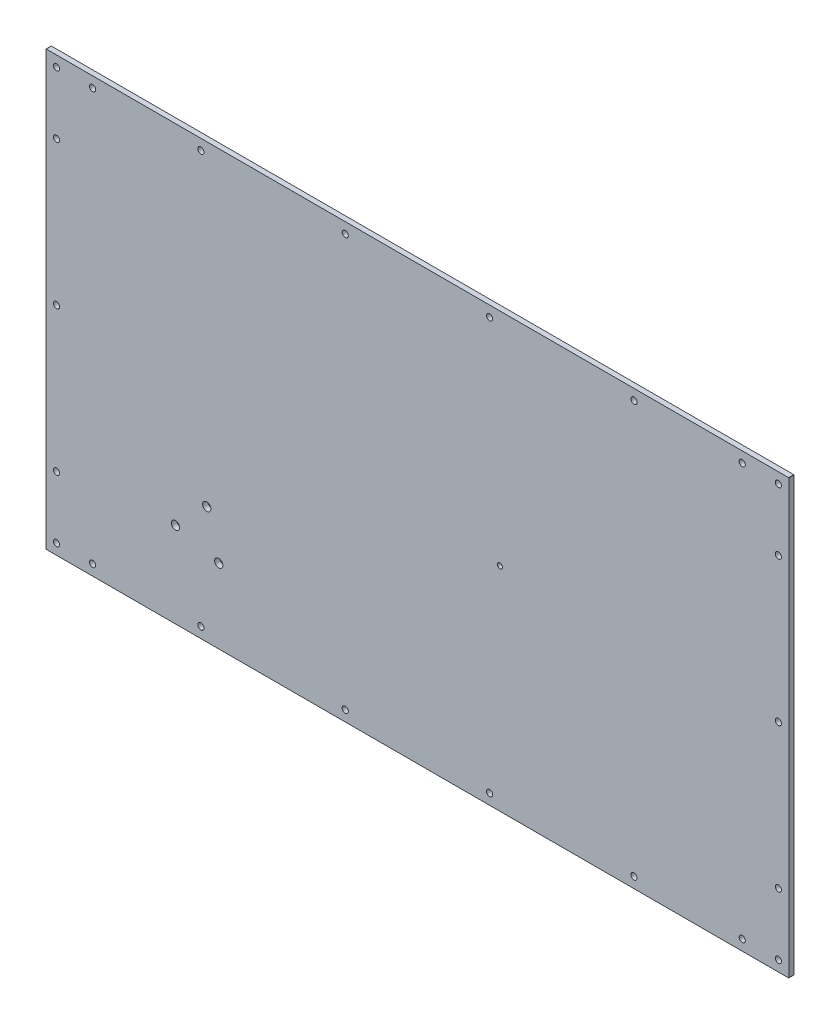
from build123d import *

# Parameters (mm, degrees)
SKETCH1_W           = 914.4
SKETCH1_H           = 533.4
BOSS_EXTRUDE1_DEPTH = 6.35
FILLET1_R           = 0.254
SKETCH2_R           = 5.08
CUT_EXTRUDE1_DEPTH  = 1028.431551458
SKETCH3_R           = 3.81
CUT_EXTRUDE2_DEPTH  = 1028.431551458
SKETCH4_R           = 3.175
CUT_EXTRUDE3_DEPTH  = 1028.431551458


with BuildPart() as part:
    # Sketch1 → Boss-Extrude1 (new body)
    with BuildSketch(Plane.XY):
        with Locations((432.044494017, -247.90616037)):
            Rectangle(SKETCH1_W, SKETCH1_H)
    extrude(amount=BOSS_EXTRUDE1_DEPTH)

    # Fillet1
    fillet1_edges = [part.edges().sort_by_distance(p)[0] for p in [
        (-25.155505983, 18.79383963, 3.175),
        (889.244494017, 18.79383963, 3.175),
        (889.244494017, -514.60616037, 3.175),
        (-25.155505983, -514.60616037, 3.175),
    ]]
    fillet(fillet1_edges, radius=FILLET1_R)

    # Sketch2 → Cut-Extrude1 (cut, through all)
    with BuildSketch(Plane(origin=(0, 0, 0), x_dir=(-1, 0, 0), z_dir=(0, 0, -1))):
        with Locations((-187.481541945, -423.16616037)):
            Circle(SKETCH2_R)
        with Locations((-134.229494017, -409.440021384)):
            Circle(SKETCH2_R)
        with Locations((-172.742703039, -370.185464567)):
            Circle(SKETCH2_R)
    extrude(amount=-CUT_EXTRUDE1_DEPTH, mode=Mode.SUBTRACT)

    # Sketch3 → Cut-Extrude2 (cut, through all)
    with BuildSketch(Plane.XY.offset(6.35)):
        with Locations((876.344494036, 5.71283963)):
            Circle(SKETCH3_R)
        with Locations((876.344494036, -247.90616037)):
            Circle(SKETCH3_R)
        with Locations((876.344494036, -501.52516037)):
            Circle(SKETCH3_R)
        with Locations((-12.255506002, 5.71283963)):
            Circle(SKETCH3_R)
        with Locations((-12.255506002, -247.90616037)):
            Circle(SKETCH3_R)
        with Locations((-12.255506002, -501.52516037)):
            Circle(SKETCH3_R)
        with Locations((698.624494029, 5.71283963)):
            Circle(SKETCH3_R)
        with Locations((520.904494021, 5.71283963)):
            Circle(SKETCH3_R)
        with Locations((343.184494014, 5.71283963)):
            Circle(SKETCH3_R)
        with Locations((165.464494006, 5.71283963)):
            Circle(SKETCH3_R)
        with Locations((698.624494029, -501.52516037)):
            Circle(SKETCH3_R)
        with Locations((520.904494021, -501.52516037)):
            Circle(SKETCH3_R)
        with Locations((343.184494014, -501.52516037)):
            Circle(SKETCH3_R)
        with Locations((165.464494006, -501.52516037)):
            Circle(SKETCH3_R)
        with Locations((831.894494036, 5.71283963)):
            Circle(SKETCH3_R)
        with Locations((876.344494036, -70.48716037)):
            Circle(SKETCH3_R)
        with Locations((876.344494036, -425.32516037)):
            Circle(SKETCH3_R)
        with Locations((831.894494036, -501.52516037)):
            Circle(SKETCH3_R)
        with Locations((32.194493998, -501.52516037)):
            Circle(SKETCH3_R)
        with Locations((-12.255506002, -425.32516037)):
            Circle(SKETCH3_R)
        with Locations((-12.255506002, -70.48716037)):
            Circle(SKETCH3_R)
        with Locations((32.194493998, 5.71283963)):
            Circle(SKETCH3_R)
    extrude(amount=-CUT_EXTRUDE2_DEPTH, mode=Mode.SUBTRACT)

    # Sketch4 → Cut-Extrude3 (cut, through all)
    with BuildSketch(Plane.XY.offset(6.35)):
        with Locations((533.644494017, -252.98616037)):
            Circle(SKETCH4_R)
    extrude(amount=-CUT_EXTRUDE3_DEPTH, mode=Mode.SUBTRACT)


solid = part.part
